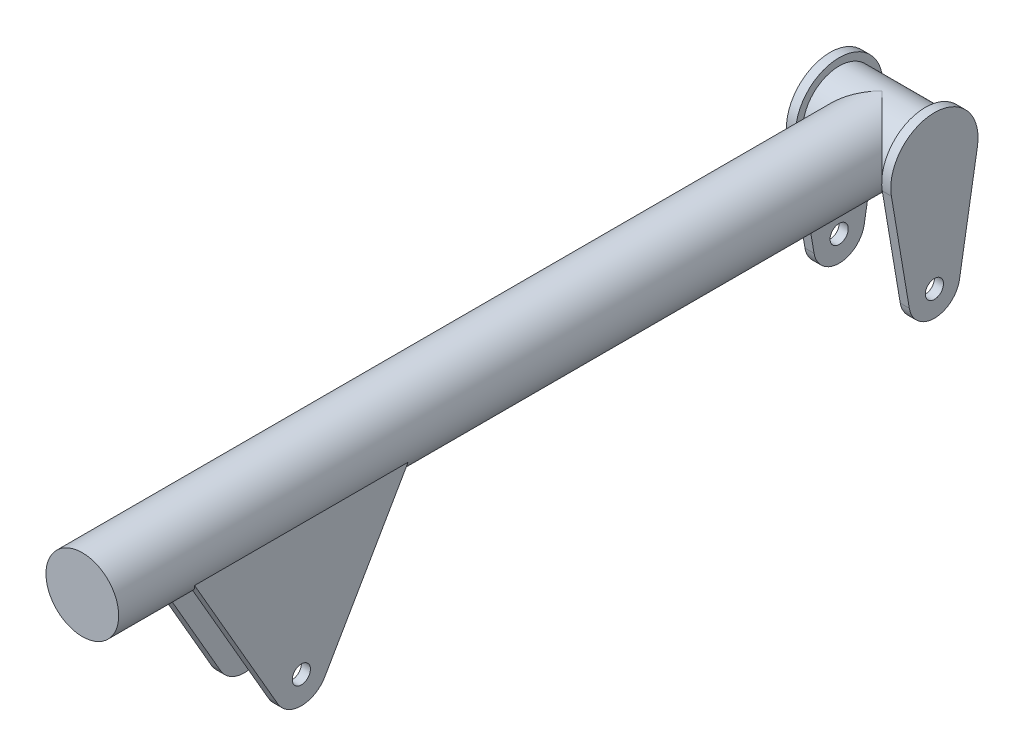
from build123d import *

# Parameters (mm, degrees)
SKETCH1_R           = 12.7
BOSS_EXTRUDE1_DEPTH = 15.0495
BOSS_EXTRUDE2_START = 18.2245
SKETCH1_6_R         = 12.7
SKETCH1_6_R_2       = 3.175
BOSS_EXTRUDE2_DEPTH = 3.175
BOSS_EXTRUDE3_START = 8.382
SKETCH1_8_R         = 3.175
BOSS_EXTRUDE3_DEPTH = 3.175
SKETCH2_R           = 12.7
BOSS_EXTRUDE4_DEPTH = 279.4


with BuildPart() as part:
    # Sketch1 → Boss-Extrude1 (new, symmetric)
    with BuildSketch(Plane.YZ):
        with Locations(Location((0, 0, 0), (0, 0, 90))):
            Circle(SKETCH1_R)
    extrude(amount=BOSS_EXTRUDE1_DEPTH, both=True)

    # Sketch1<6> → Boss-Extrude2 (add)
    # profile 1 of 2: a face of its own
    with BuildSketch(Plane.YZ.offset(BOSS_EXTRUDE2_START)):
        with BuildLine():
            Line((-39.581666667, 8.765658212), (-2.54, 15.026842649))
            ThreePointArc((-2.54, 15.026842649), (15.24, 0), (-2.54, -15.026842649))
            Line((-2.54, -15.026842649), (-39.581666667, -8.765658212))
            ThreePointArc((-39.581666667, -8.765658212), (-46.99, 0), (-39.581666667, 8.765658212))
        make_face()
        with Locations(Location((0, 0, 0), (0, 0, 90))):
            Circle(SKETCH1_6_R, mode=Mode.SUBTRACT)
        with Locations(Location((-38.1, 0, 0), (0, 0, 270))):
            Circle(SKETCH1_6_R_2, mode=Mode.SUBTRACT)
    # profile 2 of 2: a face of its own
    with BuildSketch(Plane.YZ.offset(BOSS_EXTRUDE2_START)):
        with Locations(Location((0, 0, 0), (0, 0, 90))):
            Circle(SKETCH1_6_R)
    extrude(amount=-BOSS_EXTRUDE2_DEPTH)



with BuildPart() as body_2:
    # Sketch1<8> → Boss-Extrude3 (new body)
    with BuildSketch(Plane.YZ.offset(BOSS_EXTRUDE3_START)):
        with BuildLine():
            Line((-55.5625, 206.208595243), (0, 174.129570911))
            Line((0, 174.129570911), (0, 254.785403517))
            Line((0, 254.785403517), (-55.5625, 222.706379185))
            ThreePointArc((-55.5625, 222.706379185), (-60.325, 214.457487214), (-55.5625, 206.208595243))
        make_face()
        with Locations(Location((-50.8, 214.457487214, 0), (0, 0, 270))):
            Circle(SKETCH1_8_R, mode=Mode.SUBTRACT)
    extrude(amount=BOSS_EXTRUDE3_DEPTH)


with BuildPart() as part_1:
    add(part.part)

    add(body_2.part)  # Boss-Extrude4 merges body 2
    # Sketch2 → Boss-Extrude4 (add)
    with BuildSketch(Plane(origin=(0, 0, 0), x_dir=(-1, 0, 0), z_dir=(0, 0, 1))):
        with Locations(Location((0, 0, 0), (0, 0, 270))):
            Circle(SKETCH2_R)
    extrude(amount=BOSS_EXTRUDE4_DEPTH)

    # Mirror1: part across plane


with BuildPart() as part_2:
    add(part_1.part)
    add(part_1.part.mirror(Plane(origin=(0, 0, 0), x_dir=(0, 0, 1), z_dir=(1, 0, 0))))


solid = part_2.part
